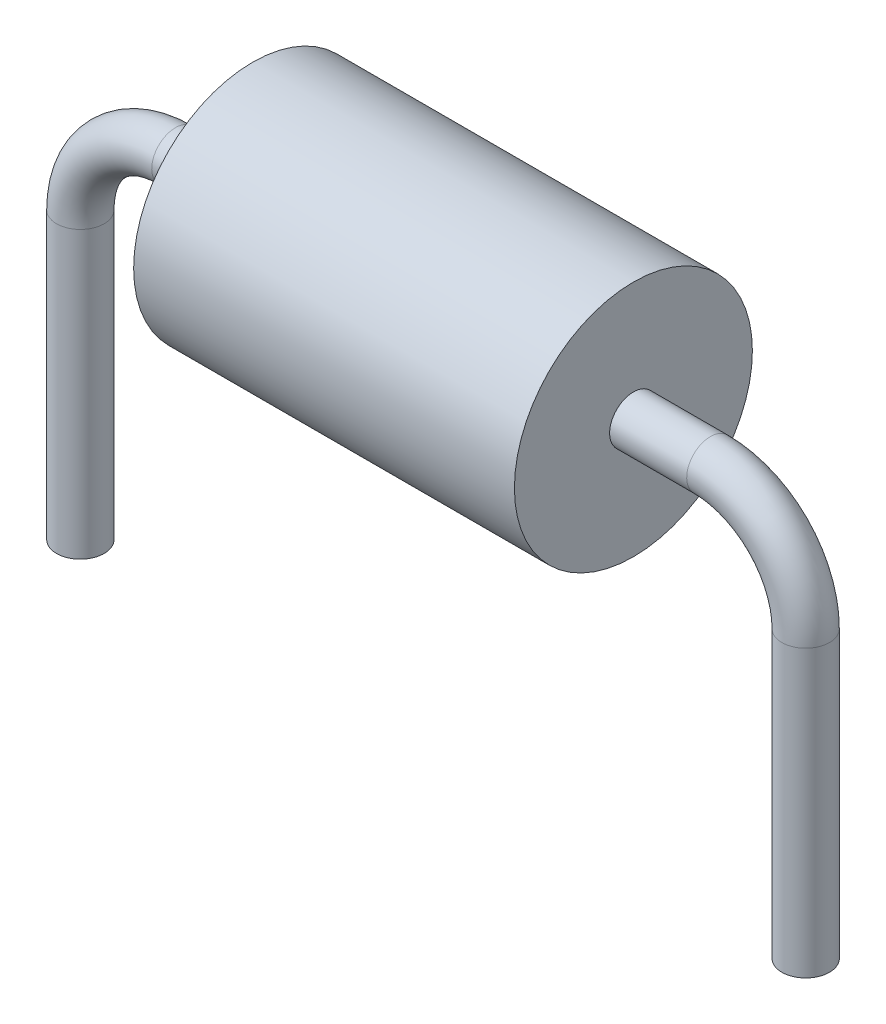
from build123d import *

# Parameters (mm, degrees)
SKETCH2_W = 2
SKETCH2_H = 1.25
SKETCH3_R = 0.25


with BuildPart() as part:
    # Sketch2 → Revolve1 (revolve)
    with BuildSketch(Plane.XY, mode=Mode.PRIVATE) as revolve1_sk:
        with Locations((1, -0.625)):
            Rectangle(SKETCH2_W, SKETCH2_H)
    revolve1 = revolve(revolve1_sk.sketch.rotate(Axis((0, 0, 0), (1, 0, 0)), 270), axis=Axis((0, 0, 0), (1, 0, 0)))

    # Sweep1: sweep along a path in Sketch1
    with BuildLine(Plane.XY) as sweep1_path:
        Line((2, 0), (2.81, 0))
        ThreePointArc((2.81, 0), (3.517106781, -0.292893219), (3.81, -1))
        Line((3.81, -1), (3.81, -4))
    # Sketch3 → Sweep1 (sweep)
    with BuildSketch(Plane(origin=(2, 0, 0), x_dir=(0, 0, -1), z_dir=(1, 0, 0))):
        Circle(SKETCH3_R)
    sweep1 = sweep(path=sweep1_path.line)

    # Mirror1: Revolve1, Sweep1 across plane
    add(revolve1.mirror(Plane.ZY))
    add(sweep1.mirror(Plane.ZY))


solid = part.part
